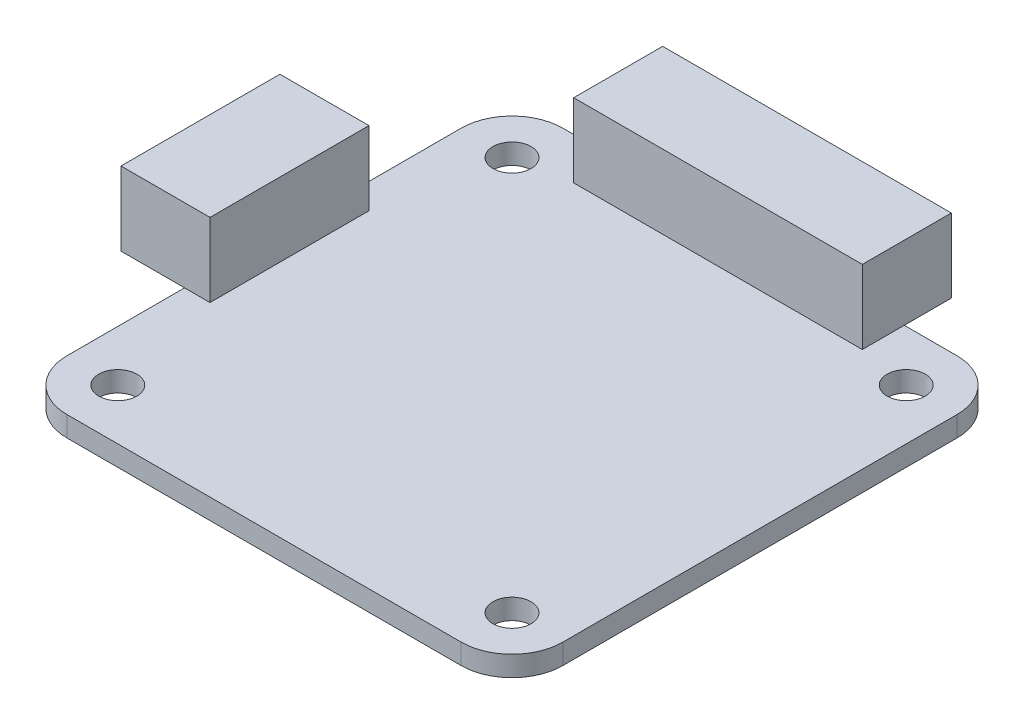
from build123d import *

# Parameters (mm, degrees)
SKETCH_1_R      = 1.5
EXTRUDE_1_DEPTH = 1.6
EXTRUDE_START   = 1.6
SKETCH_2_W      = 22.7
SKETCH_2_H      = 7
SKETCH_2_W_2    = 7
SKETCH_2_H_2    = 12.5
EXTRUDE_2_DEPTH = 5.8


with BuildPart() as part:
    # 草图1 → 凸台-拉伸1 (new body)
    with BuildSketch(Plane(origin=(0, 0, 0), x_dir=(1, 0, 0), z_dir=(0, 1, 0))):
        with BuildLine():
            Line((-15.5, -19.5), (15.5, -19.5))
            ThreePointArc((15.5, -19.5), (18.328427125, -18.328427125), (19.5, -15.5))
            Line((19.5, -15.5), (19.5, 15.5))
            ThreePointArc((19.5, 15.5), (18.328427125, 18.328427125), (15.5, 19.5))
            Line((15.5, 19.5), (-15.5, 19.5))
            ThreePointArc((-15.5, 19.5), (-18.328427125, 18.328427125), (-19.5, 15.5))
            Line((-19.5, 15.5), (-19.5, -15.5))
            ThreePointArc((-19.5, -15.5), (-18.328427125, -18.328427125), (-15.5, -19.5))
        make_face()
        with Locations(Location((-15.5, -15.5, 0), (0, 0, 270))):
            Circle(SKETCH_1_R, mode=Mode.SUBTRACT)
        with Locations(Location((15.5, -15.5, 0), (0, 0, 270))):
            Circle(SKETCH_1_R, mode=Mode.SUBTRACT)
        with Locations(Location((-15.5, 15.5, 0), (0, 0, 270))):
            Circle(SKETCH_1_R, mode=Mode.SUBTRACT)
        with Locations(Location((15.5, 15.5, 0), (0, 0, 270))):
            Circle(SKETCH_1_R, mode=Mode.SUBTRACT)
    extrude(amount=EXTRUDE_1_DEPTH)

    # 草图2 → 凸台-拉伸2 (add)
    with BuildSketch(Plane(origin=(0, 0, 0), x_dir=(1, 0, 0), z_dir=(0, 1, 0)).offset(EXTRUDE_START)):
        with Locations((0, 19.7)):
            Rectangle(SKETCH_2_W, SKETCH_2_H)
        with Locations((-21, 0)):
            Rectangle(SKETCH_2_W_2, SKETCH_2_H_2)
    extrude(amount=EXTRUDE_2_DEPTH)


solid = part.part
